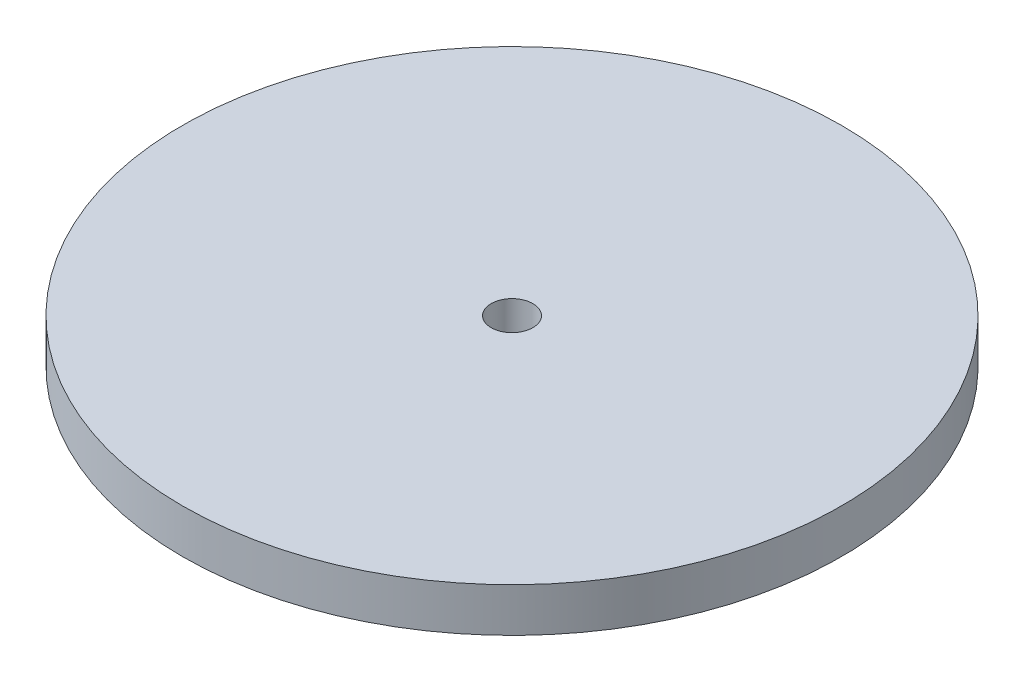
from build123d import *

# Parameters (mm, degrees)
SKETCH1_R           = 15
BOSS_EXTRUDE1_DEPTH = 2
SKETCH2_R           = 0.95
CUT_EXTRUDE1_DEPTH  = 2


with BuildPart() as part:
    # Sketch1 → Boss-Extrude1 (new body)
    with BuildSketch(Plane(origin=(0, 0, 0), x_dir=(1, 0, 0), z_dir=(0, 1, 0))):
        with Locations(Location((0, 0, 0), (0, 0, 270))):
            Circle(SKETCH1_R)
    extrude(amount=BOSS_EXTRUDE1_DEPTH)

    # Sketch2 → Cut-Extrude1 (cut)
    with BuildSketch(Plane(origin=(0, 2, 0), x_dir=(1, 0, 0), z_dir=(0, 1, 0))):
        with Locations(Location((0, 0, 0), (0, 0, 270))):
            Circle(SKETCH2_R)
    extrude(amount=-CUT_EXTRUDE1_DEPTH, mode=Mode.SUBTRACT)


solid = part.part
